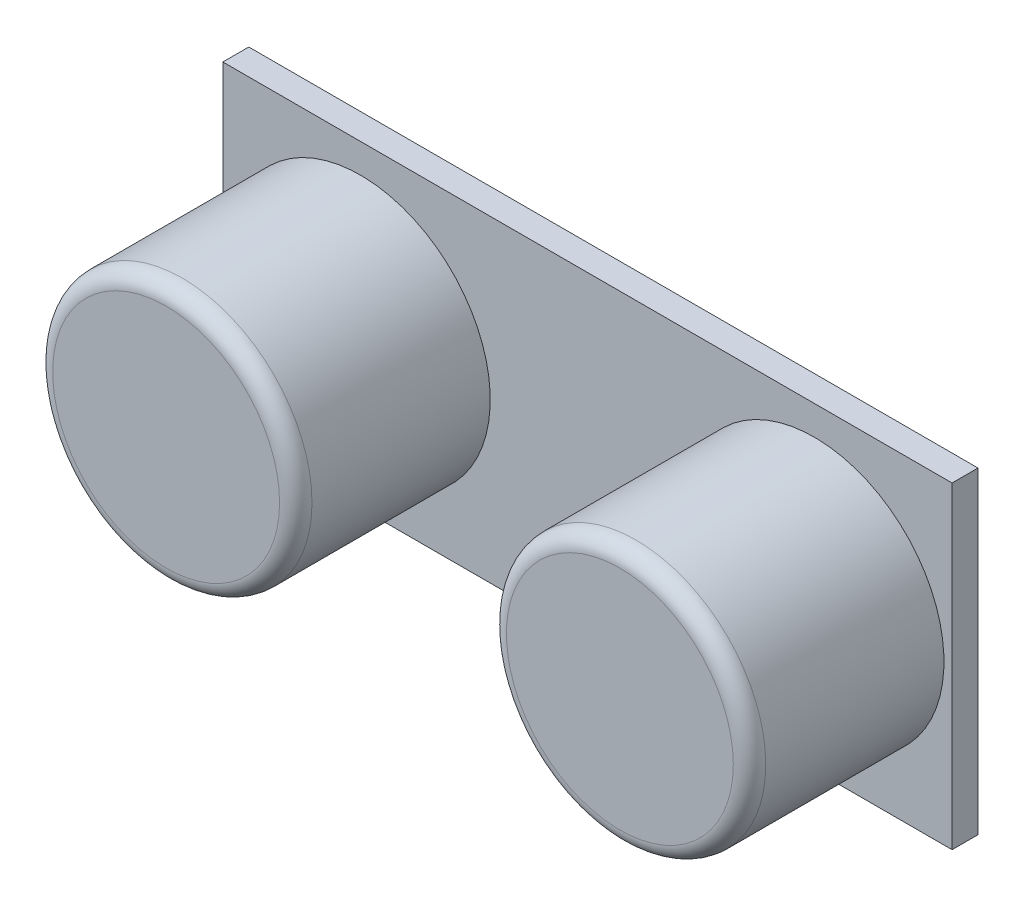
from build123d import *

# Parameters (mm, degrees)
SKETCH_1_W      = 45
SKETCH_1_H      = 19.6
EXTRUDE_1_DEPTH = 1.6
SKETCH_2_R      = 8
EXTRUDE_2_DEPTH = 12
FILLET_1_R      = 1


with BuildPart() as part:
    # 草图1 → 凸台-拉伸1 (new body)
    with BuildSketch(Plane.XY):
        with Locations((22.5, 9.8)):
            Rectangle(SKETCH_1_W, SKETCH_1_H)
    extrude(amount=EXTRUDE_1_DEPTH)

    # 草图2 → 凸台-拉伸2 (add)
    with BuildSketch(Plane.XY.offset(1.6)):
        with Locations(Location((8.5, 9.8, 0), (0, 0, 180))):
            Circle(SKETCH_2_R)
        with Locations(Location((36.5, 9.8, 0), (0, 0, 180))):
            Circle(SKETCH_2_R)
    extrude(amount=EXTRUDE_2_DEPTH)

    # 圆角1
    fillet_1_edges = [part.edges().sort_by_distance(p)[0] for p in [
        (16.5, 9.8, 13.6),
        (44.5, 9.8, 13.6),
    ]]
    fillet(fillet_1_edges, radius=FILLET_1_R)


solid = part.part
